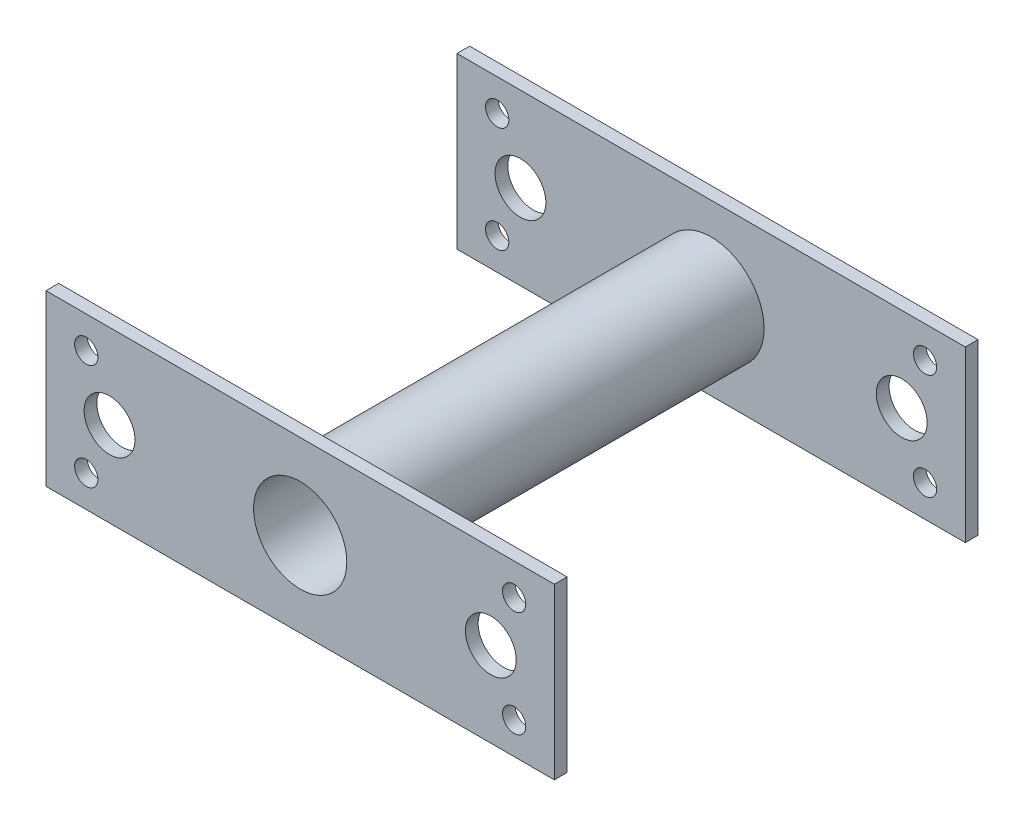
from build123d import *

# Parameters (mm, degrees)
SKETCH_1_W               = 120
SKETCH_1_H               = 40
EXTRUDE_1_DEPTH          = 3
SKETCH_2_R               = 12.5
EXTRUDE_2_DEPTH          = 94
SKETCH_3_W               = 120
SKETCH_3_H               = 40
EXTRUDE_3_DEPTH          = 3
CUT_EXTRUDE_1_DEPTH      = 119.321595662
CUT_EXTRUDE_1_DEPTH_BACK = 119.321595662
SKETCH_4_R               = 11
SKETCH_5_R               = 2.75
CUT_EXTRUDE_2_DEPTH      = 119.321595662
SKETCH_6_R               = 6
CUT_EXTRUDE_3_DEPTH      = 119.321595662


with BuildPart() as part:
    # 草图1 → 凸台-拉伸1 (new body)
    with BuildSketch(Plane.XY):
        Rectangle(SKETCH_1_W, SKETCH_1_H)
    extrude(amount=EXTRUDE_1_DEPTH)

    # 草图2 → 凸台-拉伸2 (add)
    with BuildSketch(Plane.XY.offset(3)):
        Circle(SKETCH_2_R)
    extrude(amount=EXTRUDE_2_DEPTH)

    # 草图3 → 凸台-拉伸3 (add)
    with BuildSketch(Plane.XY.offset(97)):
        Rectangle(SKETCH_3_W, SKETCH_3_H)
    extrude(amount=EXTRUDE_3_DEPTH)

    # 草图4 → 切除-拉伸1 (cut, two sides: drawn at the far end of the back side and taken through both)
    with BuildSketch(Plane.XY.offset(100).offset(-CUT_EXTRUDE_1_DEPTH_BACK)):
        Circle(SKETCH_4_R)
    extrude(amount=CUT_EXTRUDE_1_DEPTH + CUT_EXTRUDE_1_DEPTH_BACK, mode=Mode.SUBTRACT)

    # 草图5 → 切除-拉伸2 (cut, through all)
    with BuildSketch(Plane.XY.offset(100)):
        with Locations((-50.5, 12.5)):
            Circle(SKETCH_5_R)
        with Locations((-50.5, -12.5)):
            Circle(SKETCH_5_R)
        with Locations((50.5, 12.5)):
            Circle(SKETCH_5_R)
        with Locations((50.5, -12.5)):
            Circle(SKETCH_5_R)
    extrude(amount=-CUT_EXTRUDE_2_DEPTH, mode=Mode.SUBTRACT)

    # 草图6 → 切除-拉伸3 (cut, through all)
    with BuildSketch(Plane.XY.offset(100)):
        with Locations((45, 0)):
            Circle(SKETCH_6_R)
        with Locations((-45, 0)):
            Circle(SKETCH_6_R)
    extrude(amount=-CUT_EXTRUDE_3_DEPTH, mode=Mode.SUBTRACT)


solid = part.part
